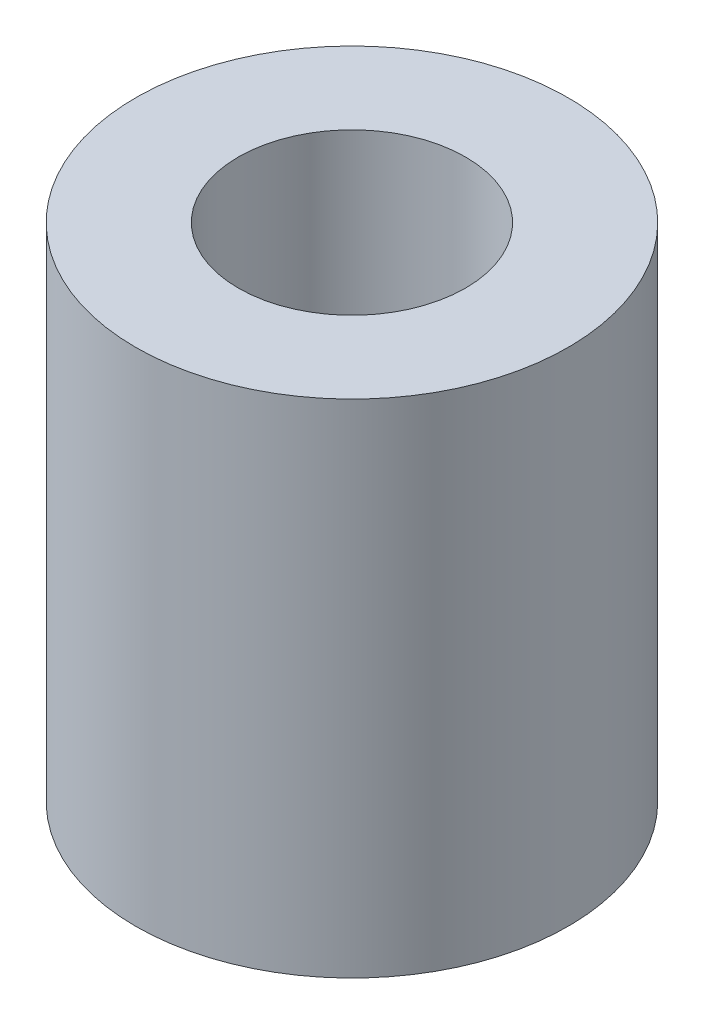
from build123d import *

# Parameters (mm, degrees)
SKETCH1_R           = 6.9
BOSS_EXTRUDE1_DEPTH = 16
SKETCH2_R           = 3.625
CUT_EXTRUDE1_DEPTH  = 14


with BuildPart() as part:
    # Sketch1 → Boss-Extrude1 (new body)
    with BuildSketch(Plane(origin=(0, 0, 0), x_dir=(1, 0, 0), z_dir=(0, 1, 0))):
        with Locations(Location((0, 0, 0), (0, 0, 270))):
            Circle(SKETCH1_R)
    extrude(amount=BOSS_EXTRUDE1_DEPTH)

    # Sketch2 → Cut-Extrude1 (cut)
    with BuildSketch(Plane(origin=(0, 16, 0), x_dir=(1, 0, 0), z_dir=(0, 1, 0))):
        with Locations(Location((0, 0, 0), (0, 0, 270))):
            Circle(SKETCH2_R)
    extrude(amount=-CUT_EXTRUDE1_DEPTH, mode=Mode.SUBTRACT)


solid = part.part
